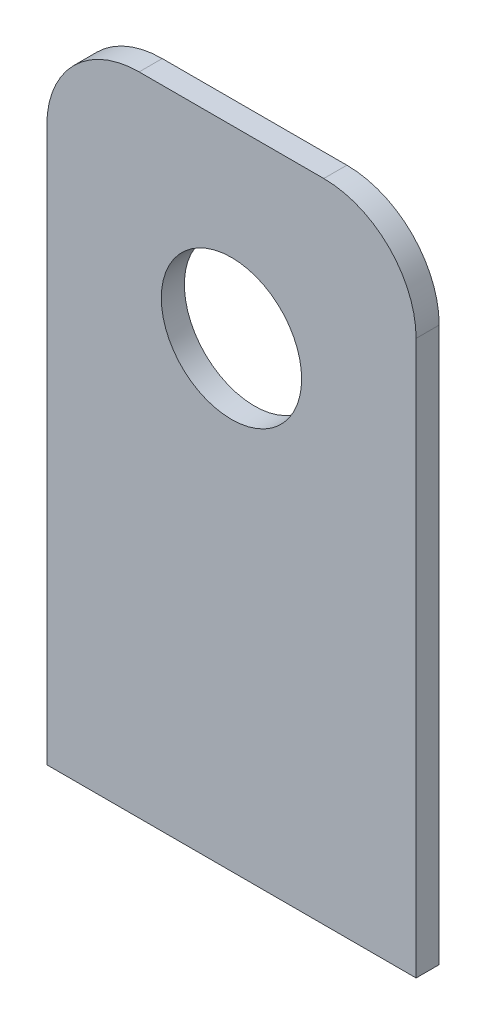
from build123d import *

# Parameters (mm, degrees)
SKETCH1_W               = 25.4
SKETCH1_H               = 31.75
BOSS_EXTRUDE1_DEPTH     = 1.5875
CUT_EXTRUDE1_DEPTH      = 35.232625611
CUT_EXTRUDE1_DEPTH_BACK = 35.232625611
SKETCH2_R               = 4.826
FILLET1_R               = 6.35
SKETCH3_W               = 25.4
SKETCH3_H               = 12.7
BOSS_EXTRUDE2_DEPTH     = 1.5875


with BuildPart() as part:
    # Sketch1 → Boss-Extrude1 (new body)
    with BuildSketch(Plane.XY):
        with Locations((0, 15.875)):
            Rectangle(SKETCH1_W, SKETCH1_H)
    extrude(amount=BOSS_EXTRUDE1_DEPTH)

    # Sketch2 → Cut-Extrude1 (cut, two sides: drawn at the far end of the back side and taken through both)
    with BuildSketch(Plane.XY.offset(1.5875).offset(-CUT_EXTRUDE1_DEPTH_BACK)):
        with Locations((0, 19.05)):
            Circle(SKETCH2_R)
    extrude(amount=CUT_EXTRUDE1_DEPTH + CUT_EXTRUDE1_DEPTH_BACK, mode=Mode.SUBTRACT)

    # Fillet1
    fillet1_edges = [part.edges().sort_by_distance(p)[0] for p in [
        (-12.7, 31.75, 0.79375),
        (12.7, 31.75, 0.79375),
    ]]
    fillet(fillet1_edges, radius=FILLET1_R)

    # Sketch3 → Boss-Extrude2 (add)
    with BuildSketch(Plane(origin=(0, 0, 0), x_dir=(-1, 0, 0), z_dir=(0, 0, -1))):
        with Locations((0, -6.35)):
            Rectangle(SKETCH3_W, SKETCH3_H)
    extrude(amount=-BOSS_EXTRUDE2_DEPTH)


solid = part.part
